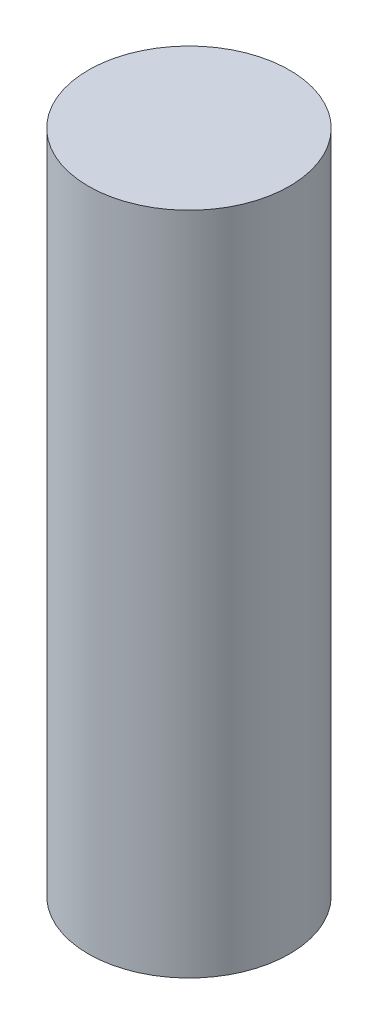
from build123d import *

# Parameters (mm, degrees)
SKETCH1_R           = 17.4
BOSS_EXTRUDE1_DEPTH = 115


with BuildPart() as part:
    # Sketch1 → Boss-Extrude1 (new body)
    with BuildSketch(Plane(origin=(0, 0, 0), x_dir=(1, 0, 0), z_dir=(0, 1, 0))):
        with Locations(Location((0, 0, 0), (0, 0, 270))):
            Circle(SKETCH1_R)
    extrude(amount=BOSS_EXTRUDE1_DEPTH)


solid = part.part
